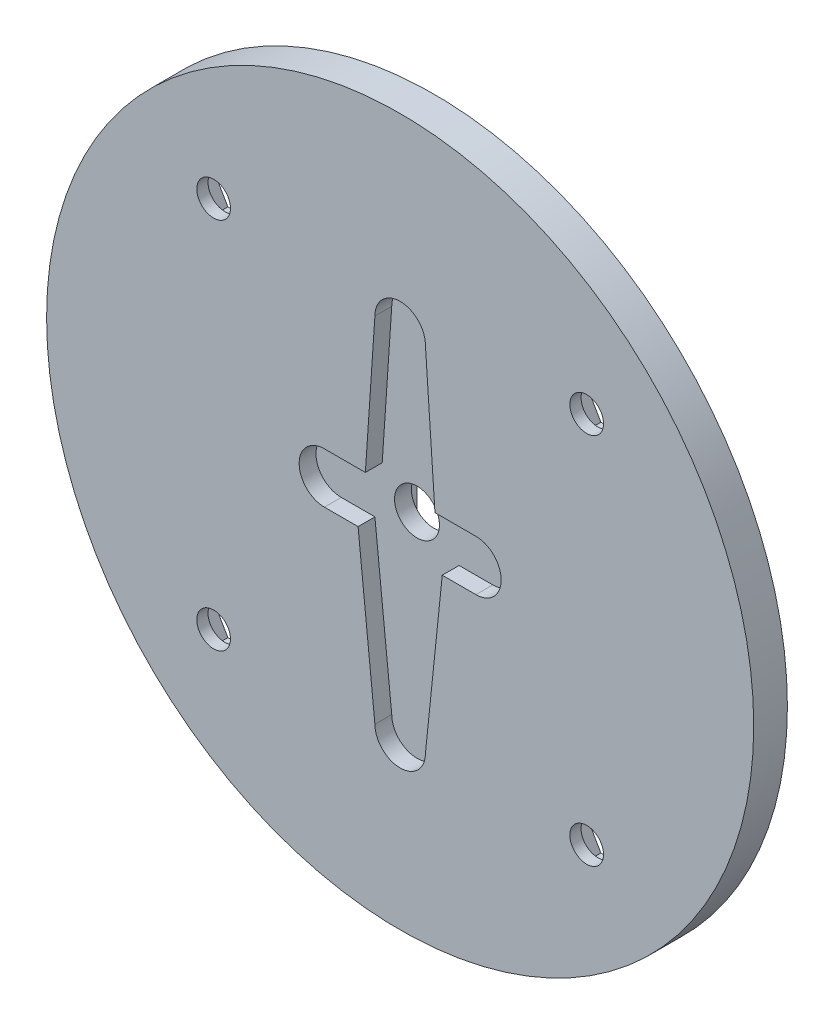
from build123d import *

# Parameters (mm, degrees)
CROQUIS1_R              = 31.5
CROQUIS1_R_2            = 1.5
CROQUIS1_R_3            = 2
SALIENTE_EXTRUIR1_DEPTH = 3
CORTAR_EXTRUIR2_DEPTH   = 1.5
CROQUIS4_W              = 15
CROQUIS4_H              = 25
SALIENTE_EXTRUIR2_DEPTH = 3
SALIENTE_EXTRUIR3_DEPTH = 25
CORTAR_EXTRUIR3_DEPTH   = 23
SALIENTE_EXTRUIR4_DEPTH = 5
CORTAR_EXTRUIR4_DEPTH   = 2


with BuildPart() as part:
    # Croquis1 → Saliente-Extruir1 (new body)
    with BuildSketch(Plane.XY):
        with Locations((-43.449193048, 8.207110309)):
            Circle(CROQUIS1_R)
        with Locations((-60.066202406, 24.824119667)):
            Circle(CROQUIS1_R_2, mode=Mode.SUBTRACT)
        with Locations((-26.83218369, 24.824119667)):
            Circle(CROQUIS1_R_2, mode=Mode.SUBTRACT)
        with Locations((-26.83218369, -8.409899049)):
            Circle(CROQUIS1_R_2, mode=Mode.SUBTRACT)
        with Locations((-60.066202406, -8.409899049)):
            Circle(CROQUIS1_R_2, mode=Mode.SUBTRACT)
        with Locations((-43.449193048, 8.207110309)):
            Circle(CROQUIS1_R_3, mode=Mode.SUBTRACT)
    extrude(amount=SALIENTE_EXTRUIR1_DEPTH)

    # Croquis3 → Cortar-Extruir2 (cut)
    with BuildSketch(Plane.XY.offset(3)):
        with BuildLine():
            Line((-41.199193048, 22.957110309), (-40.349193048, 10.457110309))
            Line((-40.349193048, 10.457110309), (-36.699193048, 10.457110309))
            ThreePointArc((-36.699193048, 10.457110309), (-34.449193048, 8.207110309), (-36.699193048, 5.957110309))
            Line((-36.699193048, 5.957110309), (-39.699193048, 5.957110309))
            Line((-39.699193048, 5.957110309), (-41.199193048, -8.542889691))
            ThreePointArc((-41.199193048, -8.542889691), (-43.449193048, -10.792889691), (-45.699193048, -8.542889691))
            Line((-45.699193048, -8.542889691), (-47.199193048, 5.957110309))
            Line((-47.199193048, 5.957110309), (-50.199193048, 5.957110309))
            ThreePointArc((-50.199193048, 5.957110309), (-52.449193048, 8.207110309), (-50.199193048, 10.457110309))
            Line((-50.199193048, 10.457110309), (-46.549193048, 10.457110309))
            Line((-46.549193048, 10.457110309), (-45.699193048, 22.957110309))
            ThreePointArc((-45.699193048, 22.957110309), (-43.449193048, 25.207110309), (-41.199193048, 22.957110309))
        make_face()
    extrude(amount=-CORTAR_EXTRUIR2_DEPTH, mode=Mode.SUBTRACT)

    # Croquis4 → Saliente-Extruir2 (add)
    with BuildSketch(Plane(origin=(0, 0, 0), x_dir=(-1, 0, 0), z_dir=(0, 0, -1))):
        with Locations((43.449193048, 8.207110309)):
            Rectangle(CROQUIS4_W, CROQUIS4_H)
    extrude(amount=SALIENTE_EXTRUIR2_DEPTH)

    # Croquis5 → Saliente-Extruir3 (add)
    with BuildSketch(Plane.XZ.offset(4.292889691)):
        Polygon((-35.949193048, 0), (-32.949193048, 0), (-35.949193048, -3), align=None)
        Polygon((-50.949193048, 0), (-53.949193048, 0), (-50.949193048, -3), align=None)
    extrude(amount=-SALIENTE_EXTRUIR3_DEPTH)

    # Croquis6 → Cortar-Extruir3 (cut)
    with BuildSketch(Plane.XZ.offset(4.292889691)):
        Polygon((-35.949193048, 0), (-50.949193048, 0), (-47.949193048, -3), (-38.949193048, -3), align=None)
    extrude(amount=-CORTAR_EXTRUIR3_DEPTH, mode=Mode.SUBTRACT)

    # Croquis7 → Saliente-Extruir4 (add)
    with BuildSketch(Plane.XZ.offset(4.292889691)):
        Polygon((-39.149193048, -3), (-36.649193048, -0.5), (-36.249193048, -0.5), (-38.749193048, -3), align=None)
        Polygon((-50.249193048, -0.5), (-50.649193048, -0.5), (-48.149193048, -3), (-47.749193048, -3), align=None)
    extrude(amount=SALIENTE_EXTRUIR4_DEPTH)

    # Croquis8 → Cortar-Extruir4 (cut)
    with BuildSketch(Plane(origin=(0, 0, 0), x_dir=(-1, 0, 0), z_dir=(0, 0, -1))):
        Polygon((30.296285305, 24.824119667), (28.564234497, 27.824119667), (25.100132882, 27.824119667), (23.368082075, 24.824119667), (25.100132882, 21.824119667), (28.564234497, 21.824119667), align=None)
        Polygon((63.530304021, 24.824119667), (61.798253213, 27.824119667), (58.334151598, 27.824119667), (56.60210079, 24.824119667), (58.334151598, 21.824119667), (61.798253213, 21.824119667), align=None)
        Polygon((30.296285305, -8.409899049), (28.564234497, -5.409899049), (25.100132882, -5.409899049), (23.368082075, -8.409899049), (25.100132882, -11.409899049), (28.564234497, -11.409899049), align=None)
        Polygon((63.530304021, -8.409899049), (61.798253213, -5.409899049), (58.334151598, -5.409899049), (56.60210079, -8.409899049), (58.334151598, -11.409899049), (61.798253213, -11.409899049), align=None)
    extrude(amount=-CORTAR_EXTRUIR4_DEPTH, mode=Mode.SUBTRACT)


solid = part.part
